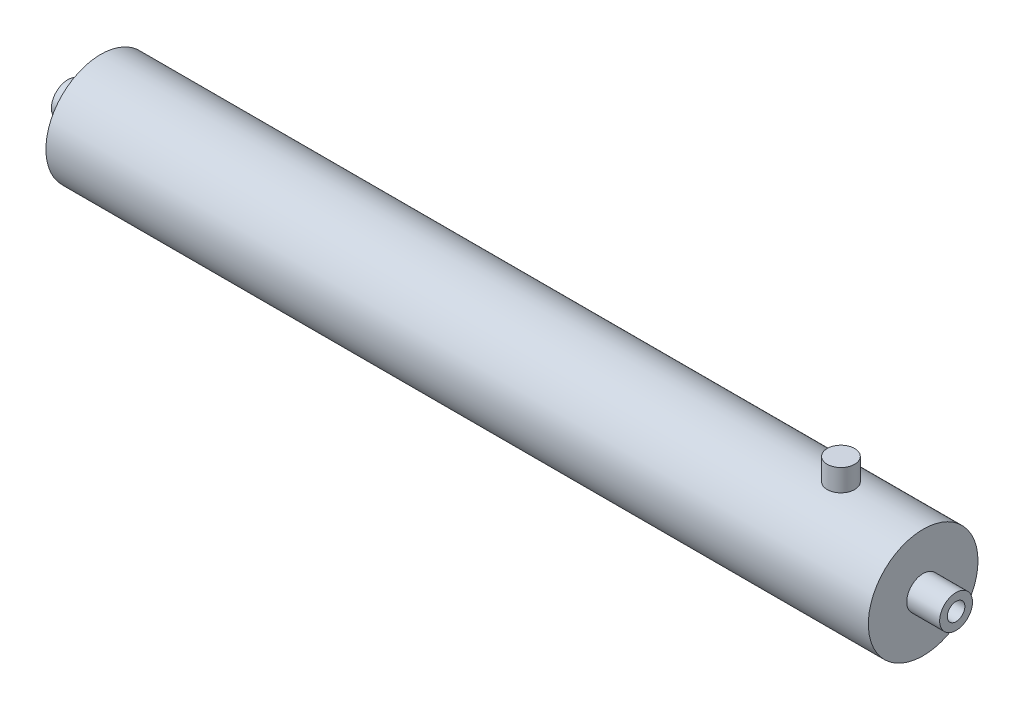
from build123d import *

# Parameters (mm, degrees)
BODY_START             = -150
SKETCH1_R              = 20
BODY_DEPTH             = 300
INLET_PORT_START       = -162
SKETCH2_R              = 6
INLET_PORT_DEPTH       = 12
INLET_SOCKET_START     = -162
SKETCH3_R              = 3.2
INLET_SOCKET_DEPTH     = 10
OUTLET_PORT_START      = 150
SKETCH4_R              = 6
OUTLET_PORT_DEPTH      = 12
OUTLET_SOCKET_START    = 152
SKETCH5_R              = 3.2
OUTLET_SOCKET_DEPTH    = 10
LAMP_CABLE_GLAND_START = 20
SKETCH6_R              = 5
LAMP_CABLE_GLAND_DEPTH = 8


with BuildPart() as part:
    # Sketch1 → Body (new body)
    with BuildSketch(Plane(origin=(0, 0, 0), x_dir=(0, 0, -1), z_dir=(1, 0, 0)).offset(BODY_START)):
        Circle(SKETCH1_R)
    extrude(amount=BODY_DEPTH)

    # Sketch2 → Inlet_Port (add)
    with BuildSketch(Plane(origin=(0, 0, 0), x_dir=(0, 0, -1), z_dir=(1, 0, 0)).offset(INLET_PORT_START)):
        Circle(SKETCH2_R)
    extrude(amount=INLET_PORT_DEPTH)

    # Sketch3 → Inlet_Socket (cut)
    with BuildSketch(Plane(origin=(0, 0, 0), x_dir=(0, 0, -1), z_dir=(1, 0, 0)).offset(INLET_SOCKET_START)):
        Circle(SKETCH3_R)
    extrude(amount=INLET_SOCKET_DEPTH, mode=Mode.SUBTRACT)

    # Sketch4 → Outlet_Port (add)
    with BuildSketch(Plane(origin=(0, 0, 0), x_dir=(0, 0, -1), z_dir=(1, 0, 0)).offset(OUTLET_PORT_START)):
        Circle(SKETCH4_R)
    extrude(amount=OUTLET_PORT_DEPTH)

    # Sketch5 → Outlet_Socket (cut)
    with BuildSketch(Plane(origin=(0, 0, 0), x_dir=(0, 0, -1), z_dir=(1, 0, 0)).offset(OUTLET_SOCKET_START)):
        Circle(SKETCH5_R)
    extrude(amount=OUTLET_SOCKET_DEPTH, mode=Mode.SUBTRACT)


with BuildPart() as body_2:
    # Sketch6 → Lamp_Cable_Gland (new body)
    with BuildSketch(Plane(origin=(0, 0, 0), x_dir=(1, 0, 0), z_dir=(0, 1, 0)).offset(LAMP_CABLE_GLAND_START)):
        with Locations(Location((120, 0, 0), (0, 0, 270))):
            Circle(SKETCH6_R)
    extrude(amount=LAMP_CABLE_GLAND_DEPTH)


solid = Compound([part.part, body_2.part])
